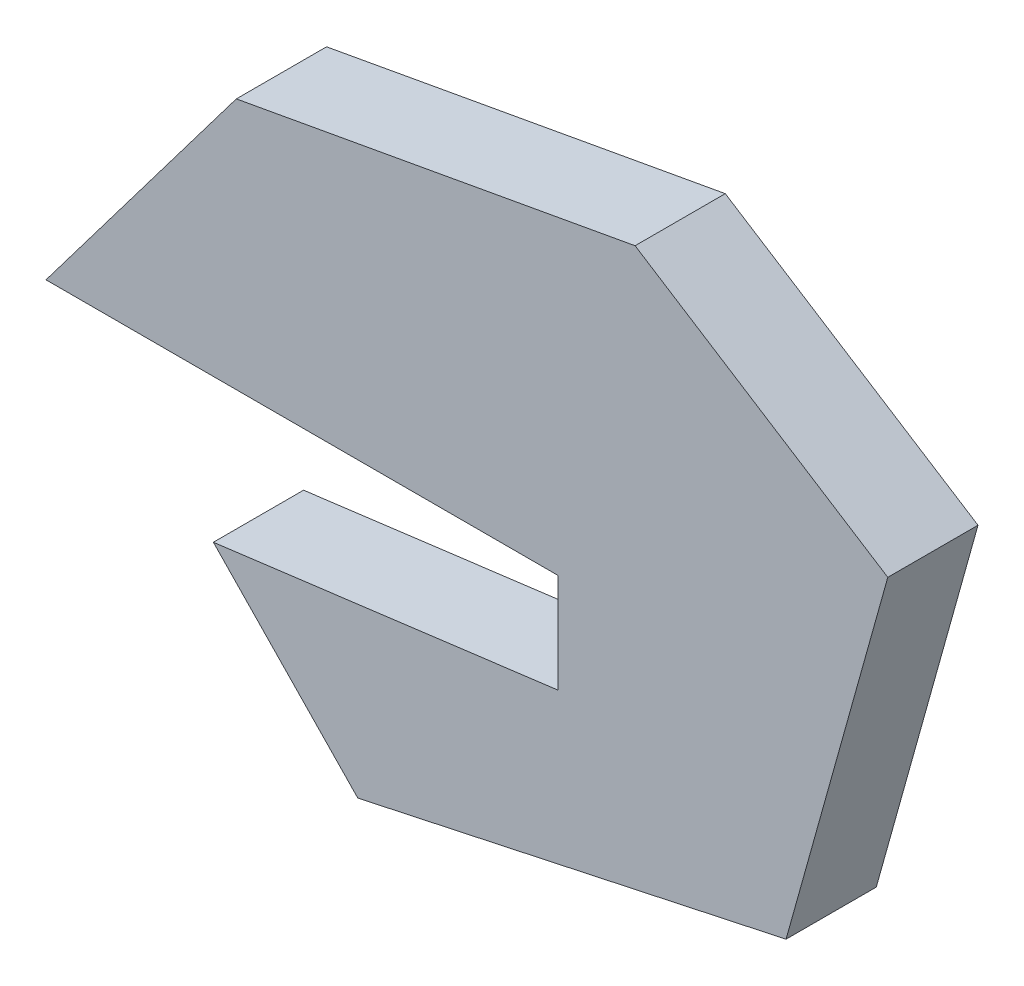
from build123d import *

# Parameters (mm, degrees)
BOSS_EXTRUDE1_DEPTH = 20


with BuildPart() as part:
    # Sketch1 → Boss-Extrude1 (new body)
    with BuildSketch(Plane.XY):
        Polygon((0, 0), (-113.512762238, 0), (-71.309299355, 55.846823729), (17.099678927, 71.855033789), (73.128414134, 36.200384111), (50.571390869, -44.568312097), (-44.386400619, -64.942397627), (-76.402820737, -31.83450864), (0, -22.01928494), align=None)
    extrude(amount=BOSS_EXTRUDE1_DEPTH)


solid = part.part
